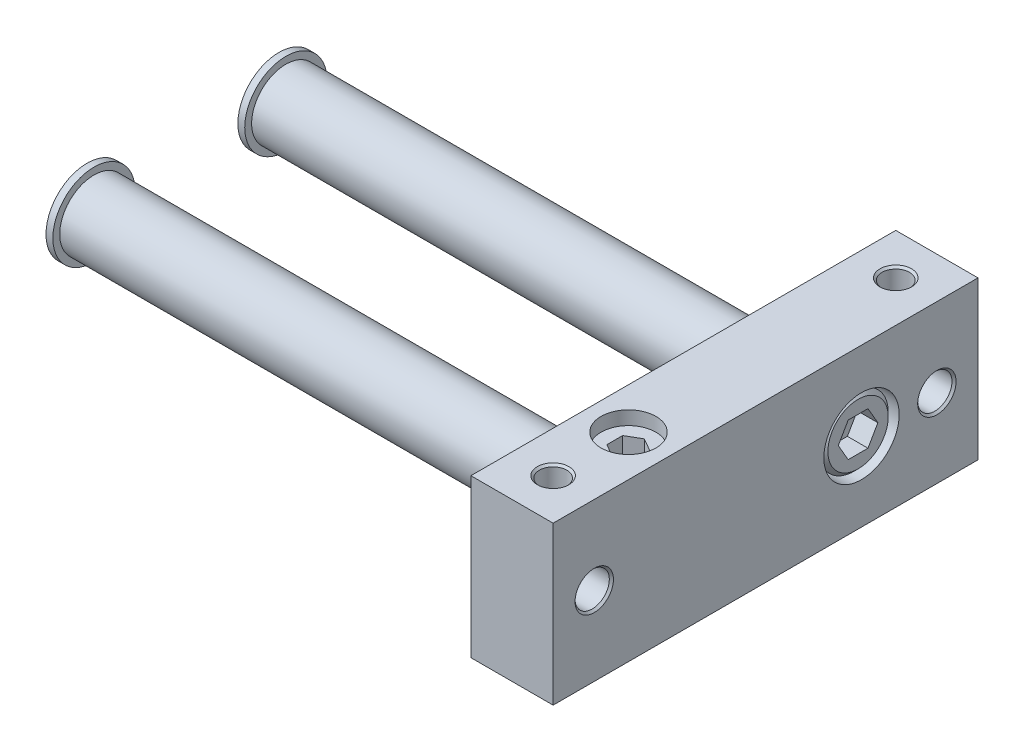
from build123d import *

# Parameters (mm, degrees)
PLATE_SKETCH_W               = 62
PLATE_SKETCH_H               = 23
PLATE_DEPTH                  = 12
TAPPED_HOLE_FACE_D           = 5
TAPPED_HOLE_FACE_CSINK_D     = 5.6
TAPPED_HOLE_FACE_CSINK_ANGLE = 90
RODS_DEPTH                   = 60
RODS_DEPTH_BACK              = 24
RODS_SKETCH_R                = 5
PISTON_SKETCH_R              = 6
PISTON_DEPTH                 = 1
TAPPED_HOLES_TOP_AT_2_COUNT  = 2
TAPPED_HOLES_TOP_AT_2_PITCH  = 50
SHCS_SEAT_SKETCH_R           = 5.5
SHCS_SEAT_DEPTH              = 6.5
SHCS_HEAD_SKETCH_R           = 5
SHCS_HEAD_DEPTH              = 6
SHCS_HEX_DEPTH               = 3
SHCS_CHAM_SIZE               = 0.6
SS_SEAT_SKETCH_R             = 4
SS_SEAT_DEPTH                = 2
SS_HEX_DEPTH                 = 4


with BuildPart() as part:
    # Plate_Sketch → Plate (new body)
    with BuildSketch(Plane(origin=(0, 0, 0), x_dir=(0, 0, -1), z_dir=(1, 0, 0))):
        Rectangle(PLATE_SKETCH_W, PLATE_SKETCH_H)
    extrude(amount=PLATE_DEPTH)

    # Tapped Hole Face (through all)
    with Locations(Plane(origin=(12, 0, 0), x_dir=(0, 0, -1), z_dir=(1, 0, 0))):
        with Locations((-25, 0), (25, 0)):
            CounterSinkHole(TAPPED_HOLE_FACE_D / 2, TAPPED_HOLE_FACE_CSINK_D / 2, counter_sink_angle=TAPPED_HOLE_FACE_CSINK_ANGLE)

    # Rods_Sketch → Rods (add, two sides: drawn at the far end of the back side and taken through both)
    with BuildSketch(Plane.ZY.offset(12).offset(-RODS_DEPTH_BACK)):
        with Locations((-14, 0)):
            Circle(RODS_SKETCH_R)
        with Locations(Location((14, 0, 0), (0, 0, 180))):
            Circle(RODS_SKETCH_R)
    extrude(amount=RODS_DEPTH + RODS_DEPTH_BACK)

    # Piston_Sketch → Piston (add)
    with BuildSketch(Plane.ZY.offset(72)):
        with Locations((-14, 0)):
            Circle(PISTON_SKETCH_R)
        with Locations((14, 0)):
            Circle(PISTON_SKETCH_R)
    extrude(amount=PISTON_DEPTH)

    # Tapped Holes Top Profile → Tapped Holes Top (revolve, cut)
    with BuildSketch(Plane(origin=(6, 11.5, -25), x_dir=(0, 0, 1), z_dir=(1, 0, 0))):
        Polygon((0, 0), (0, 6.499755867), (1.7, 6.2), (1.7, 6), (2, 6), (2, 0.3), (2.3, 0), align=None)
    tapped_holes_top = revolve(axis=Axis((6, 17.85, -25), (0, -1, 0)), mode=Mode.SUBTRACT)

    # Tapped Holes Top at 2: Tapped Holes Top ×2
    with Locations(*[(0, 0, i * TAPPED_HOLES_TOP_AT_2_PITCH) for i in range(1, TAPPED_HOLES_TOP_AT_2_COUNT)]):
        add(tapped_holes_top, mode=Mode.SUBTRACT)

    # Tapped Holes Top Mirror: Tapped Holes Top across plane
    add(tapped_holes_top.mirror(Plane.ZX), mode=Mode.SUBTRACT)

    # Tapped Holes Top Mirror copy 1 sketch → Tapped Holes Top Mirror copy 1 (revolve, cut)
    with BuildSketch(Plane(origin=(6, -11.5, 25), x_dir=(0, 0, 1), z_dir=(1, 0, 0))):
        Polygon((0, 0), (0, -6.499755867), (1.7, -6.2), (1.7, -6), (2, -6), (2, -0.3), (2.3, 0), align=None)
    revolve(axis=Axis((6, -17.85, 25), (0, -1, 0)), mode=Mode.SUBTRACT)

    # SHCS Seat_Sketch → SHCS Seat (cut)
    with BuildSketch(Plane(origin=(12, 0, 0), x_dir=(0, 0, -1), z_dir=(1, 0, 0))):
        with Locations((14, 0)):
            Circle(SHCS_SEAT_SKETCH_R)
    extrude(amount=-SHCS_SEAT_DEPTH, mode=Mode.SUBTRACT)

    # SHCS Head_Sketch → SHCS Head (add)
    with BuildSketch(Plane(origin=(5.5, 0, 0), x_dir=(0, 0, -1), z_dir=(1, 0, 0))):
        with Locations(Location((14, 0, 0), (0, 0, 180))):
            Circle(SHCS_HEAD_SKETCH_R)
    extrude(amount=SHCS_HEAD_DEPTH)

    # SHCS Hex_Sketch → SHCS Hex (cut)
    with BuildSketch(Plane(origin=(11.5, 0, 0), x_dir=(0, 0, -1), z_dir=(1, 0, 0))):
        Polygon((15.443375673, -2.5), (16.886751346, 0), (15.443375673, 2.5), (12.556624327, 2.5), (11.113248654, 0), (12.556624327, -2.5), align=None)
    extrude(amount=-SHCS_HEX_DEPTH, mode=Mode.SUBTRACT)

    # SHCS Cham
    shcs_cham_edges = [part.edges().sort_by_distance(p)[0] for p in [
        (11.5, 0, -19),
    ]]
    chamfer(shcs_cham_edges, length=SHCS_CHAM_SIZE)

    # SS Seat_Sketch → SS Seat (cut)
    with BuildSketch(Plane(origin=(0, 11.5, 0), x_dir=(-1, 0, 0), z_dir=(0, 1, 0))):
        with Locations(Location((-6, 14, 0), (0, 0, 90))):
            Circle(SS_SEAT_SKETCH_R)
    extrude(amount=-SS_SEAT_DEPTH, mode=Mode.SUBTRACT)

    # SS Hex_Sketch → SS Hex (cut)
    with BuildSketch(Plane(origin=(0, 9.5, 0), x_dir=(-1, 0, 0), z_dir=(0, 1, 0))):
        Polygon((-8, 12.845299462), (-6, 11.690598923), (-4, 12.845299462), (-4, 15.154700538), (-6, 16.309401077), (-8, 15.154700538), align=None)
    extrude(amount=-SS_HEX_DEPTH, mode=Mode.SUBTRACT)


solid = part.part
